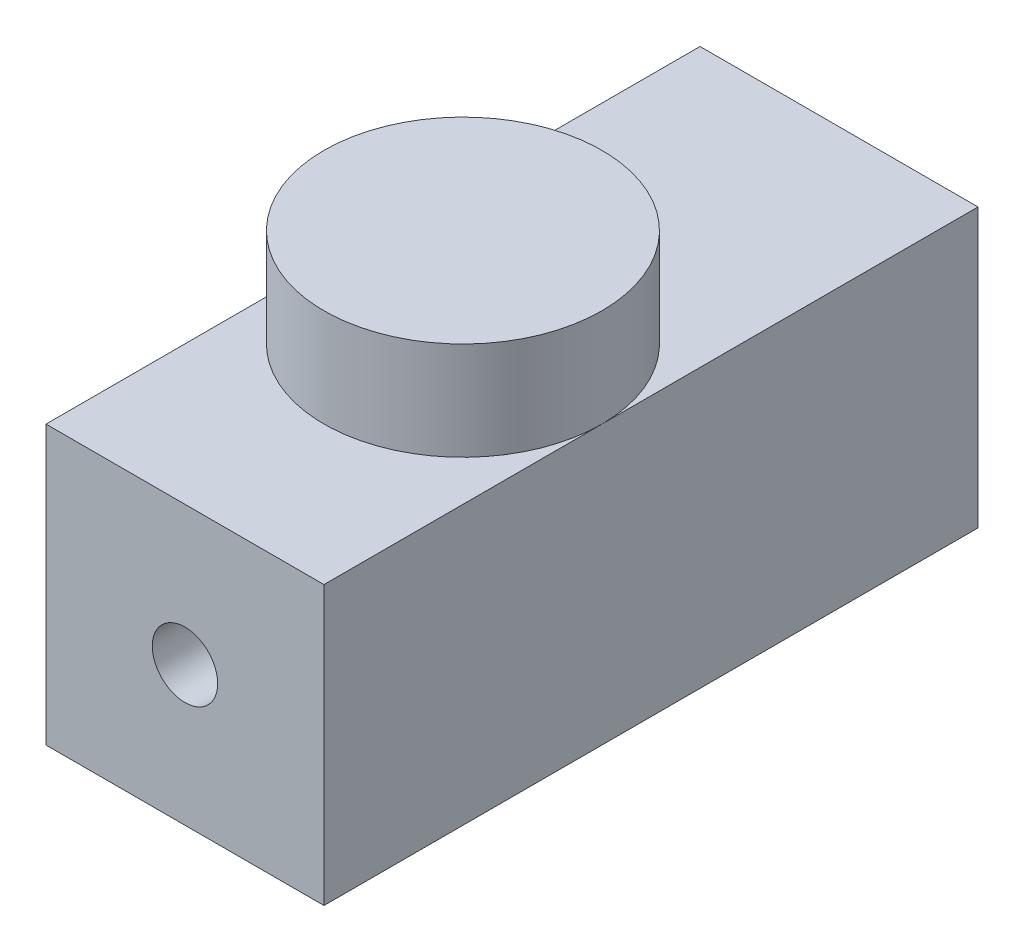
from build123d import *
from build123d.topology import SkipClean

# Parameters (mm, degrees)
SKETCH_1_W          = 17
SKETCH_1_H          = 17
SKETCH_1_R          = 3.5
EXTRUDE_1_DEPTH     = 21
SKETCH_4_W          = 17
SKETCH_4_H          = 17
EXTRUDE_2_DEPTH     = 19
SKETCH_5_R          = 3
CUT_EXTRUDE_2_DEPTH = 21
SKETCH_7_W          = 17
SKETCH_7_H          = 2.364359037
EXTRUDE_3_DEPTH     = 15
CUT_EXTRUDE_5_DEPTH = 10
SKETCH_9_R          = 3
CUT_EXTRUDE_6_DEPTH = 10
EXTRUDE_START       = 5
SKETCH_12_R         = 8.5
EXTRUDE_4_DEPTH     = 5
EXTRUDE_START_2     = 1
SKETCH_13_R         = 8.5
EXTRUDE_5_DEPTH     = 1
SKETCH_15_R         = 5.512560125
SKETCH_15_R_2       = 2
EXTRUDE_6_DEPTH     = 5
EXTRUDE_START_3     = -7
SKETCH_16_R         = 4.074487064
SKETCH_16_R_2       = 2
EXTRUDE_7_DEPTH     = 7


with BuildPart() as part:
    # Эскиз1 → Бобышка-Вытянуть1 (new body)
    with BuildSketch(Plane.XY):
        Rectangle(SKETCH_1_W, SKETCH_1_H)
        with Locations(Location((0, 0, 0), (0, 0, 180))):
            Circle(SKETCH_1_R, mode=Mode.SUBTRACT)
    extrude(amount=EXTRUDE_1_DEPTH)

    # Эскиз4 → Бобышка-Вытянуть2 (add)
    with BuildSketch(Plane(origin=(0, 0, 0), x_dir=(-1, 0, 0), z_dir=(0, 0, -1))):
        Rectangle(SKETCH_4_W, SKETCH_4_H)
    extrude(amount=EXTRUDE_2_DEPTH)

    # Эскиз5 → Вырез-Вытянуть2 (cut)
    with BuildSketch(Plane(origin=(0, 0, -19), x_dir=(-1, 0, 0), z_dir=(0, 0, -1))):
        Circle(SKETCH_5_R)
    extrude(amount=-CUT_EXTRUDE_2_DEPTH, mode=Mode.SUBTRACT)

    # Эскиз7 → Бобышка-Вытянуть3 (add)
    with BuildSketch(Plane(origin=(0, 8.5, 0), x_dir=(1, 0, 0), z_dir=(0, 1, 0))):
        with Locations((0, -1.182179519)):
            Rectangle(SKETCH_7_W, SKETCH_7_H)
    extrude(amount=-EXTRUDE_3_DEPTH)

    # Эскиз10 → Вырез-Вытянуть5 (cut)
    with BuildSketch(Plane(origin=(0, 8.5, 0), x_dir=(1, 0, 0), z_dir=(0, 1, 0))):
        with BuildLine():
            Line((-7.050086148, -4), (-4.742367561, -4))
            ThreePointArc((-4.742367561, -4), (0, 0.742367561), (4.742367561, -4))
            Line((4.742367561, -4), (7.050086148, -4))
            ThreePointArc((7.050086148, -4), (0, 3.050086148), (-7.050086148, -4))
        make_face()
    extrude(amount=-CUT_EXTRUDE_5_DEPTH, mode=Mode.SUBTRACT)

    # Эскиз9 → Вырез-Вытянуть6 (cut)
    with BuildSketch(Plane(origin=(0, 8.5, 0), x_dir=(1, 0, 0), z_dir=(0, 1, 0))):
        with Locations(Location((0, -4, 0), (0, 0, 180))):
            Circle(SKETCH_9_R)
    extrude(amount=-CUT_EXTRUDE_6_DEPTH, mode=Mode.SUBTRACT)

    # Эскиз12 → Бобышка-Вытянуть4 (add)
    with SkipClean():  # the faces are left unmerged after this step: merging them gives an invalid solid
        with BuildSketch(Plane(origin=(0, 8.5, 0), x_dir=(1, 0, 0), z_dir=(0, 1, 0)).offset(EXTRUDE_START)):
            with Locations(Location((0, -4, 0), (0, 0, 180))):
                Circle(SKETCH_12_R)
            with BuildLine():
                ThreePointArc((-7.050086148, -4), (0, 3.050086148), (7.050086148, -4))
                ThreePointArc((7.050086148, -4), (0, -11.050086148), (-7.050086148, -4))
            make_face(mode=Mode.SUBTRACT)
        extrude(amount=-EXTRUDE_4_DEPTH)

    # Эскиз13 → Бобышка-Вытянуть5 (add)
    with SkipClean():  # the faces are left unmerged after this step: merging them gives an invalid solid
        with BuildSketch(Plane(origin=(0, 13.5, 0), x_dir=(1, 0, 0), z_dir=(0, 1, 0)).offset(EXTRUDE_START_2)):
            with Locations(Location((0, -4, 0), (0, 0, 180))):
                Circle(SKETCH_13_R)
        extrude(amount=-EXTRUDE_5_DEPTH)

    # Эскиз15 → Бобышка-Вытянуть6 (add)
    with SkipClean():  # the faces are left unmerged after this step: merging them gives an invalid solid
        with BuildSketch(Plane.XY.offset(21)):
            Circle(SKETCH_15_R)
            Circle(SKETCH_15_R_2, mode=Mode.SUBTRACT)
        extrude(amount=-EXTRUDE_6_DEPTH)

    # Эскиз16 → Бобышка-Вытянуть7 (add)
    with SkipClean():  # the faces are left unmerged after this step: merging them gives an invalid solid
        with BuildSketch(Plane(origin=(0, 0, -19), x_dir=(-1, 0, 0), z_dir=(0, 0, -1)).offset(EXTRUDE_START_3)):
            Circle(SKETCH_16_R)
            with Locations(Location((0, 0, 0), (0, 0, 180))):
                Circle(SKETCH_16_R_2, mode=Mode.SUBTRACT)
        extrude(amount=EXTRUDE_7_DEPTH)


solid = part.part
